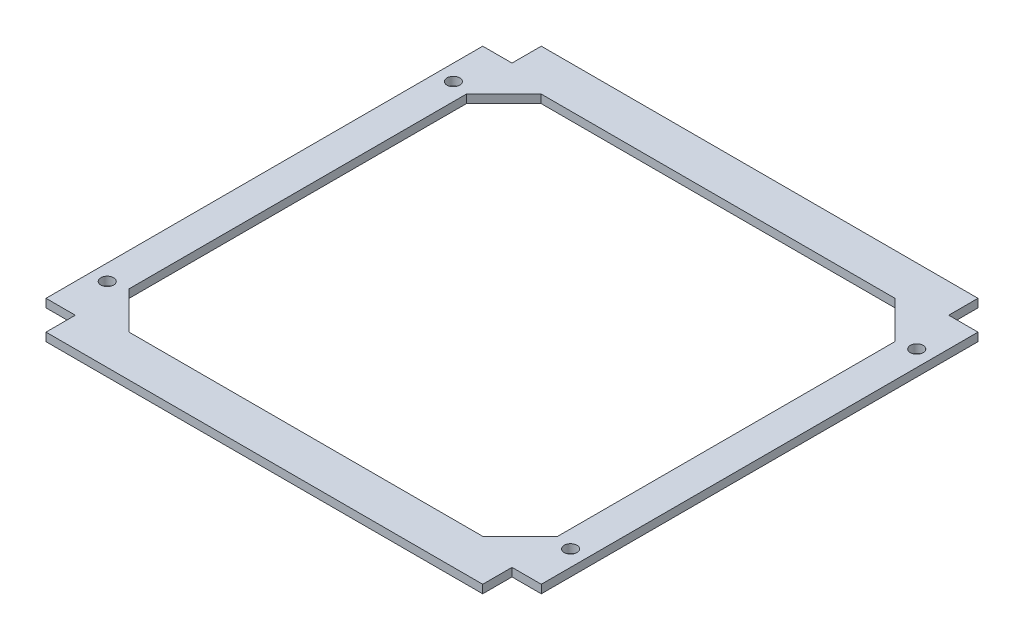
from build123d import *

# Parameters (mm, degrees)
BOSS_EXTRUDE1_DEPTH      = 1.56
CUT_EXTRUDE1_DEPTH       = 1.56
M2_CLEARANCE_HOLE1_D     = 2.4
M2_CLEARANCE_HOLE1_DEPTH = 38.1
M2_CLEARANCE_HOLE1_TIP   = 0.721032743


with BuildPart() as part:
    # Sketch1 → Boss-Extrude1 (new body)
    with BuildSketch(Plane(origin=(0, 0, 0), x_dir=(1, 0, 0), z_dir=(0, 1, 0))):
        Polygon((-41, -41), (-46.5, -41), (-46.5, 41), (-41, 41), (-41, 46.5), (41, 46.5), (41, 41), (46.5, 41), (46.5, -41), (41, -41), (41, -46.5), (-41, -46.5), align=None)
    extrude(amount=BOSS_EXTRUDE1_DEPTH)

    # Sketch2 → Cut-Extrude1 (cut)
    with BuildSketch(Plane(origin=(0, 1.56, 0), x_dir=(1, 0, 0), z_dir=(0, 1, 0))):
        Polygon((-40.243314804, 31.704788024), (-33.243314804, 38.704788024), (33.243314804, 38.704788024), (40.243314804, 31.704788024), (40.243314804, -31.704788024), (33.243314804, -38.704788024), (-33.243314804, -38.704788024), (-40.243314804, -31.704788024), align=None)
    extrude(amount=-CUT_EXTRUDE1_DEPTH, mode=Mode.SUBTRACT)

    # M2 Clearance Hole1
    with Locations(Plane(origin=(0, 1.56, 0), x_dir=(1, 0, 0), z_dir=(0, 1, 0))):
        with Locations((-43.5, -32.5), (-43.5, 32.5), (43.5, 32.5), (43.5, -32.5)):
            Hole(M2_CLEARANCE_HOLE1_D / 2, depth=M2_CLEARANCE_HOLE1_DEPTH)
            with Locations((0, 0, -(M2_CLEARANCE_HOLE1_DEPTH + M2_CLEARANCE_HOLE1_TIP / 2))):  # 118° drill point
                Cone(0, M2_CLEARANCE_HOLE1_D / 2, M2_CLEARANCE_HOLE1_TIP, mode=Mode.SUBTRACT)


solid = part.part
